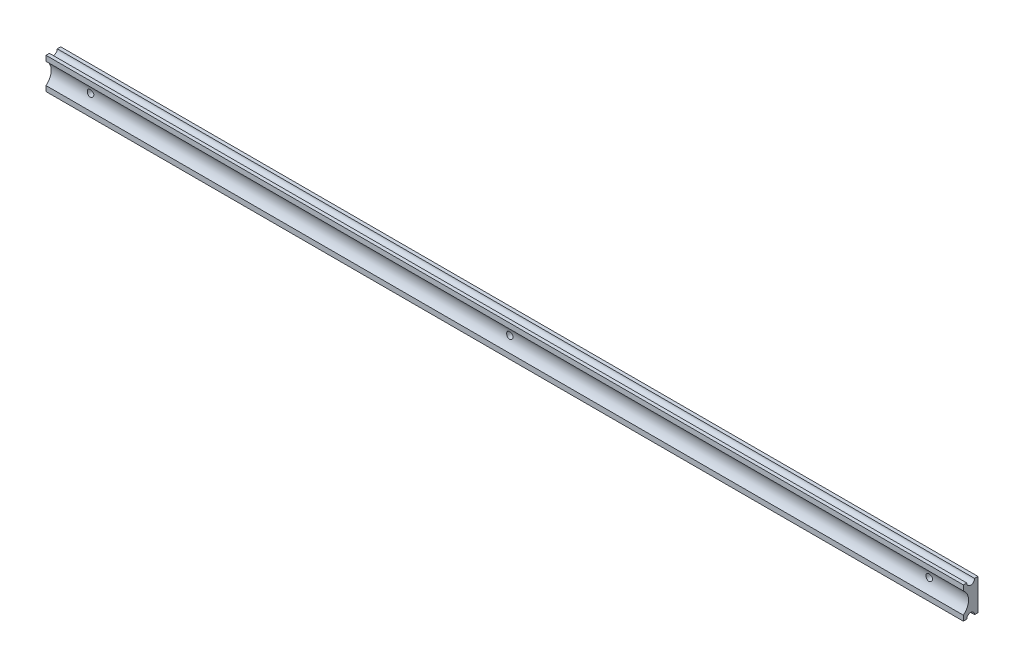
from build123d import *

# Parameters (mm, degrees)
SKETCH_1_W             = 5.6
SKETCH_1_H             = 12
EXTRUDE_1_DEPTH        = 175
SKETCH_2_R             = 1.5
CUT_EXTRUDE_1_DEPTH    = 350
SKETCH_3_R             = 5
CUT_EXTRUDE_2_DEPTH    = 350
HOLE_WIZARD_M3_1_D     = 2.5
PATTERN_LINEAR_2_COUNT = 3
PATTERN_LINEAR_2_PITCH = 160


with BuildPart() as part:
    # 草图1 → 凸台-拉伸1 (new, symmetric)
    with BuildSketch(Plane(origin=(0, 0, 0), x_dir=(0, 0, -1), z_dir=(1, 0, 0))):
        with Locations((2.8, 0)):
            Rectangle(SKETCH_1_W, SKETCH_1_H)
    extrude(amount=EXTRUDE_1_DEPTH, both=True)

    # 草图2 → 切除-拉伸1 (cut)
    with BuildSketch(Plane(origin=(175, 0, 0), x_dir=(0, 0, -1), z_dir=(1, 0, 0))):
        with Locations((2.8, 6)):
            Circle(SKETCH_2_R)
        with Locations((2.8, -6)):
            Circle(SKETCH_2_R)
    extrude(amount=-CUT_EXTRUDE_1_DEPTH, mode=Mode.SUBTRACT)

    # 草图3 → 切除-拉伸2 (cut)
    with BuildSketch(Plane(origin=(175, 0, 0), x_dir=(0, 0, -1), z_dir=(1, 0, 0))):
        with Locations((-3, 0)):
            Circle(SKETCH_3_R)
    extrude(amount=-CUT_EXTRUDE_2_DEPTH, mode=Mode.SUBTRACT)

    # M3 螺纹孔1 (through all)
    with Locations(Plane(origin=(0, 0, -5.6), x_dir=(-1, 0, 0), z_dir=(0, 0, -1))):
        with Locations((-160, 0)):
            hole_wizard_m3_1 = Hole(HOLE_WIZARD_M3_1_D / 2)

    # 阵列(线性)2: M3 螺纹孔1 ×3
    with Locations(*[(-i * PATTERN_LINEAR_2_PITCH, 0, 0) for i in range(1, PATTERN_LINEAR_2_COUNT)]):
        add(hole_wizard_m3_1, mode=Mode.SUBTRACT)


solid = part.part
